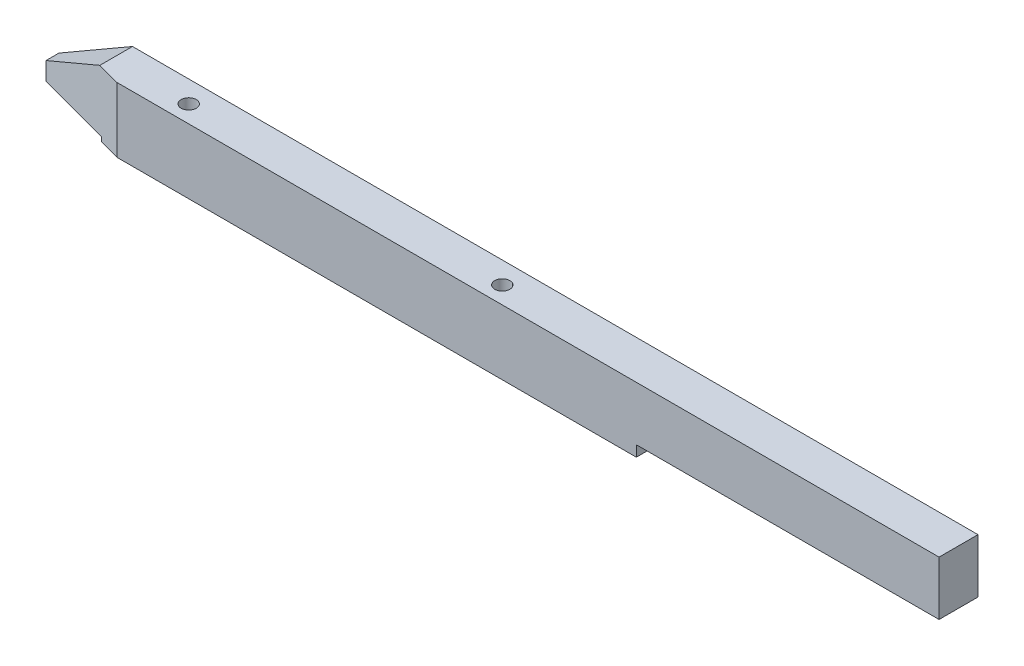
from build123d import *

# Parameters (mm, degrees)
SKIZZE1_W                       = 18
SKIZZE1_H                       = 30
AUFSATZ_LINEAR_AUSTRAGEN1_DEPTH = 212.5
FASE1_SIZE                      = 12
FASE1_SIZE2                     = 44.784609691
F_7_0_7_DURCHMESSER_BOHRUNG1_D  = 7
SKIZZE4_W                       = 140
SKIZZE4_H                       = 5
SKIZZE4_W_2                     = 35
SKIZZE4_H_2                     = 2
SCHNITT_LINEAR_AUSTRAGEN1_DEPTH = 214.787862144
SCHNITT_LINEAR_AUSTRAGEN2_DEPTH = 214.787862144


with BuildPart() as part:
    # Skizze1 → Aufsatz-Linear austragen1 (new, symmetric)
    with BuildSketch(Plane(origin=(0, 0, 0), x_dir=(0, 0, -1), z_dir=(1, 0, 0))):
        Rectangle(SKIZZE1_W, SKIZZE1_H)
    extrude(amount=AUFSATZ_LINEAR_AUSTRAGEN1_DEPTH, both=True)

    # Fase1
    fase1_edges = [part.edges().sort_by_distance(p)[0] for p in [
        (-212.5, 0, 9),
    ]]
    fase1_side = [part.faces().sort_by_distance(p)[0] for p in [
        (-212.5, 0, 0),
    ]]
    chamfer(fase1_edges, length=FASE1_SIZE, length2=FASE1_SIZE2, reference=fase1_side[0])

    # Ø7.0 (7) Durchmesser Bohrung1 (through all)
    with Locations(Plane(origin=(0, 15, 0), x_dir=(1, 0, 0), z_dir=(0, 1, 0))):
        with Locations((-142.5, -1), (2.5, -1)):
            Hole(F_7_0_7_DURCHMESSER_BOHRUNG1_D / 2)

    # Skizze4 → Schnitt-Linear austragen1 (cut, through all)
    with BuildSketch(Plane.XY.offset(9)):
        with Locations((142.5, -12.5)):
            Rectangle(SKIZZE4_W, SKIZZE4_H)
        with Locations((-195, -14)):
            Rectangle(SKIZZE4_W_2, SKIZZE4_H_2)
    extrude(amount=-SCHNITT_LINEAR_AUSTRAGEN1_DEPTH, mode=Mode.SUBTRACT)

    # Skizze5 → Schnitt-Linear austragen2 (cut, through all)
    with BuildSketch(Plane.XY.offset(9)):
        Polygon((-178.5, 15), (-212.5, 15), (-212.5, -4.629909152), align=None)
    extrude(amount=-SCHNITT_LINEAR_AUSTRAGEN2_DEPTH, mode=Mode.SUBTRACT)


solid = part.part
